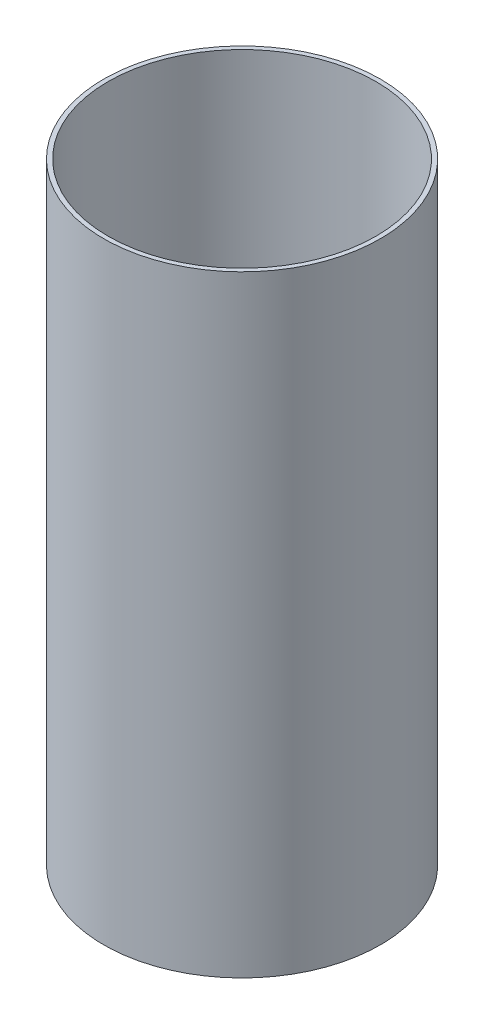
from build123d import *

# Parameters (mm, degrees)
SKETCH1_R           = 19
SKETCH1_R_2         = 18.4
BOSS_EXTRUDE1_DEPTH = 42


with BuildPart() as part:
    # Sketch1 → Boss-Extrude1 (new, symmetric)
    with BuildSketch(Plane(origin=(0, 0, 0), x_dir=(1, 0, 0), z_dir=(0, 1, 0))):
        with Locations(Location((0, 0, 0), (0, 0, 90))):
            Circle(SKETCH1_R)
        with Locations(Location((0, 0, 0), (0, 0, 90))):
            Circle(SKETCH1_R_2, mode=Mode.SUBTRACT)
    extrude(amount=BOSS_EXTRUDE1_DEPTH, both=True)


solid = part.part
